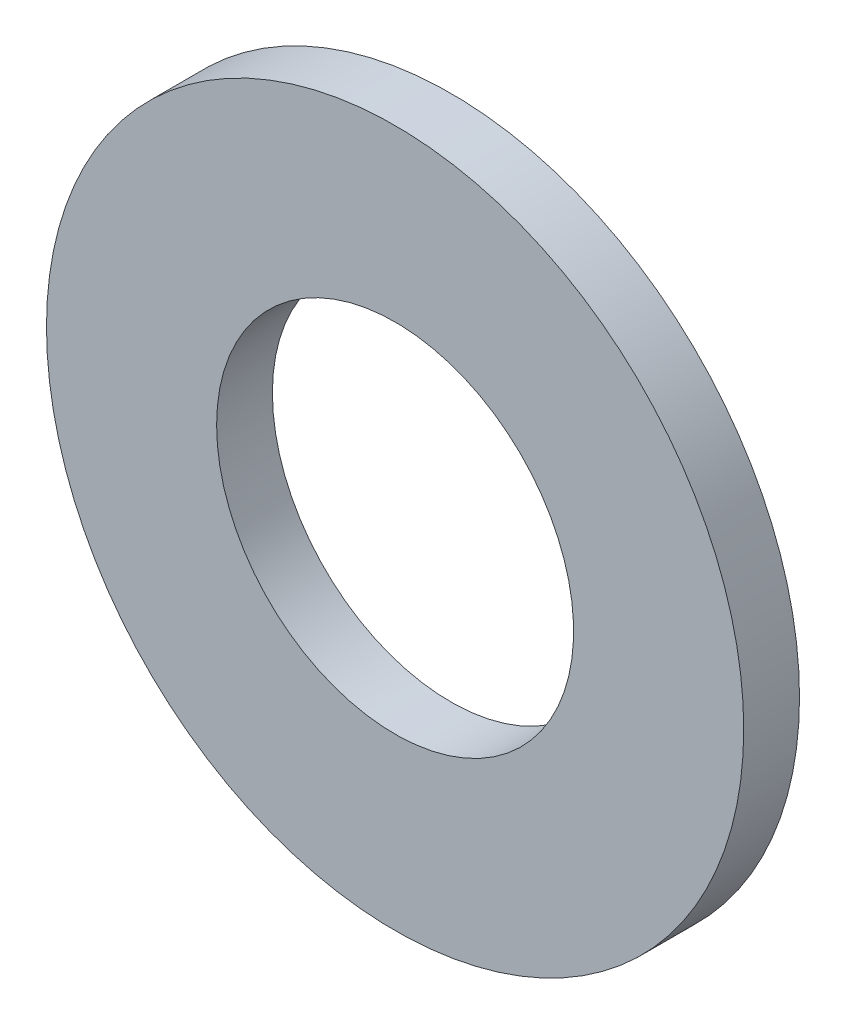
from build123d import *

# Parameters (mm, degrees)
ESQUISSE1_R        = 6.25
ESQUISSE1_R_2      = 3.2
BOSS_EXTRU_1_DEPTH = 1


with BuildPart() as part:
    # Esquisse1 → Boss.-Extru.1 (new body)
    with BuildSketch(Plane.XY):
        with Locations(Location((0, 0, 0), (0, 0, 180))):
            Circle(ESQUISSE1_R)
        with Locations(Location((0, 0, 0), (0, 0, 180))):
            Circle(ESQUISSE1_R_2, mode=Mode.SUBTRACT)
    extrude(amount=BOSS_EXTRU_1_DEPTH)


solid = part.part
